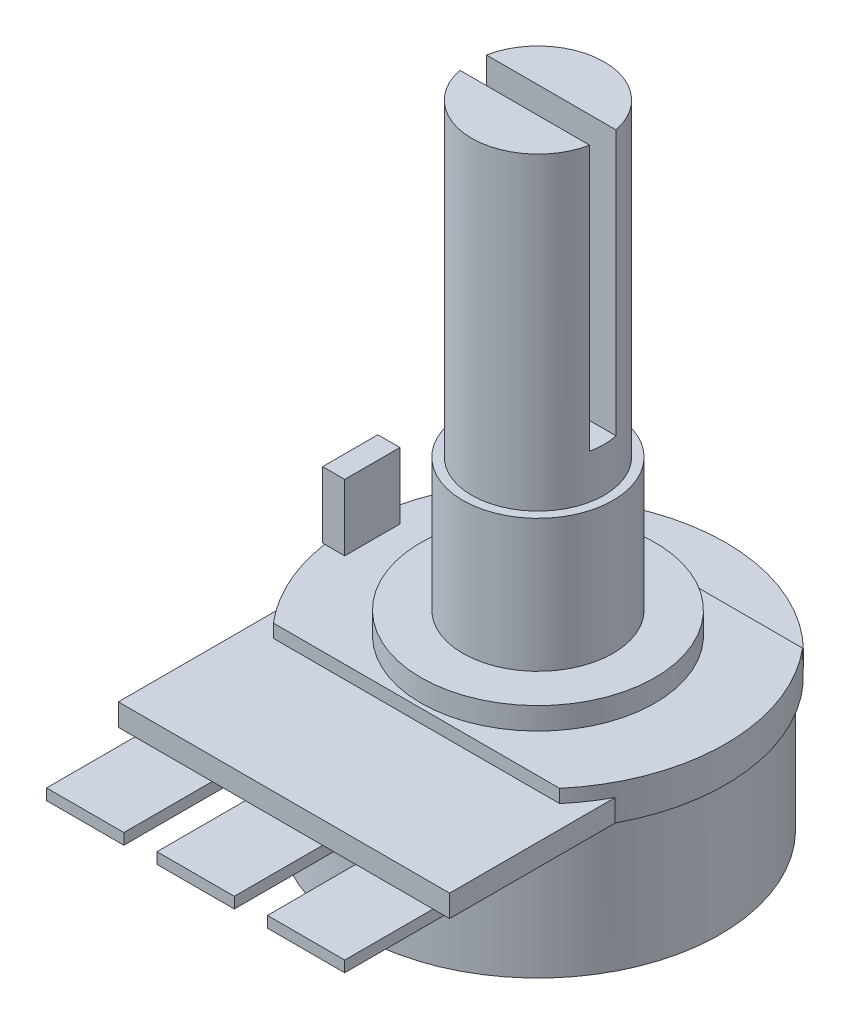
from build123d import *

# Parameters (mm, degrees)
SKETCH1_R           = 5.3
BOSS_EXTRUDE1_DEPTH = 1
SKETCH2_R           = 3.4
BOSS_EXTRUDE2_DEPTH = 6
SKETCH3_R           = 3
BOSS_EXTRUDE3_DEPTH = 14
SKETCH4_W           = 8
SKETCH4_H           = 1.2
CUT_EXTRUDE1_DEPTH  = 12
BOSS_EXTRUDE4_DEPTH = 0.6
BOSS_EXTRUDE5_DEPTH = 1
SKETCH7_R           = 8.25
BOSS_EXTRUDE6_DEPTH = 6
SKETCH8_W           = 3.5
SKETCH8_H           = 8
BOSS_EXTRUDE7_DEPTH = 0.5
SKETCH9_W           = 1
SKETCH9_H           = 2.5
BOSS_EXTRUDE8_DEPTH = 3


with BuildPart() as part:
    # Sketch1 → Boss-Extrude1 (new body)
    with BuildSketch(Plane(origin=(0, 0, 0), x_dir=(1, 0, 0), z_dir=(0, 1, 0))):
        with Locations(Location((0, 0, 0), (0, 0, 270))):
            Circle(SKETCH1_R)
    extrude(amount=-BOSS_EXTRUDE1_DEPTH)

    # Sketch2 → Boss-Extrude2 (add)
    with BuildSketch(Plane(origin=(0, 0, 0), x_dir=(1, 0, 0), z_dir=(0, 1, 0))):
        with Locations(Location((0, 0, 0), (0, 0, 270))):
            Circle(SKETCH2_R)
    extrude(amount=BOSS_EXTRUDE2_DEPTH)

    # Sketch3 → Boss-Extrude3 (add)
    with BuildSketch(Plane(origin=(0, 6, 0), x_dir=(1, 0, 0), z_dir=(0, 1, 0))):
        with Locations(Location((0, 0, 0), (0, 0, 270))):
            Circle(SKETCH3_R)
    extrude(amount=BOSS_EXTRUDE3_DEPTH)

    # Sketch4 → Cut-Extrude1 (cut)
    with BuildSketch(Plane(origin=(0, 20, 0), x_dir=(1, 0, 0), z_dir=(0, 1, 0))):
        Rectangle(SKETCH4_W, SKETCH4_H)
    extrude(amount=-CUT_EXTRUDE1_DEPTH, mode=Mode.SUBTRACT)

    # Sketch5 → Boss-Extrude4 (add)
    with BuildSketch(Plane.XZ.offset(1)):
        with BuildLine():
            Line((-6.480740698, 5.5), (6.480740698, 5.5))
            ThreePointArc((6.480740698, 5.5), (8.5, 0), (6.480740698, -5.5))
            Line((6.480740698, -5.5), (-6.480740698, -5.5))
            ThreePointArc((-6.480740698, -5.5), (-8.5, 0), (-6.480740698, 5.5))
        make_face()
    extrude(amount=BOSS_EXTRUDE4_DEPTH)

    # Sketch6 → Boss-Extrude5 (add)
    with BuildSketch(Plane.XZ.offset(1.6)):
        with BuildLine():
            Line((7.5, 4), (7.5, 11.5))
            Line((7.5, 11.5), (-7.5, 11.5))
            Line((-7.5, 11.5), (-7.5, 4))
            ThreePointArc((-7.5, 4), (0, -8.5), (7.5, 4))
        make_face()
    extrude(amount=BOSS_EXTRUDE5_DEPTH)

    # Sketch7 → Boss-Extrude6 (add)
    with BuildSketch(Plane.XZ.offset(2.6)):
        with Locations(Location((0, 0, 0), (0, 0, 270))):
            Circle(SKETCH7_R)
    extrude(amount=BOSS_EXTRUDE6_DEPTH)

    # Sketch8 → Boss-Extrude7 (add)
    with BuildSketch(Plane.XZ.offset(2.6)):
        with Locations((-5, 11.5)):
            Rectangle(SKETCH8_W, SKETCH8_H)
        with Locations((0, 11.5)):
            Rectangle(SKETCH8_W, SKETCH8_H)
        with Locations((5, 11.5)):
            Rectangle(SKETCH8_W, SKETCH8_H)
    extrude(amount=BOSS_EXTRUDE7_DEPTH)

    # Sketch9 → Boss-Extrude8 (add)
    with BuildSketch(Plane(origin=(0, -1, 0), x_dir=(1, 0, 0), z_dir=(0, 1, 0))):
        with Locations((-8, 0)):
            Rectangle(SKETCH9_W, SKETCH9_H)
    extrude(amount=BOSS_EXTRUDE8_DEPTH)


solid = part.part
